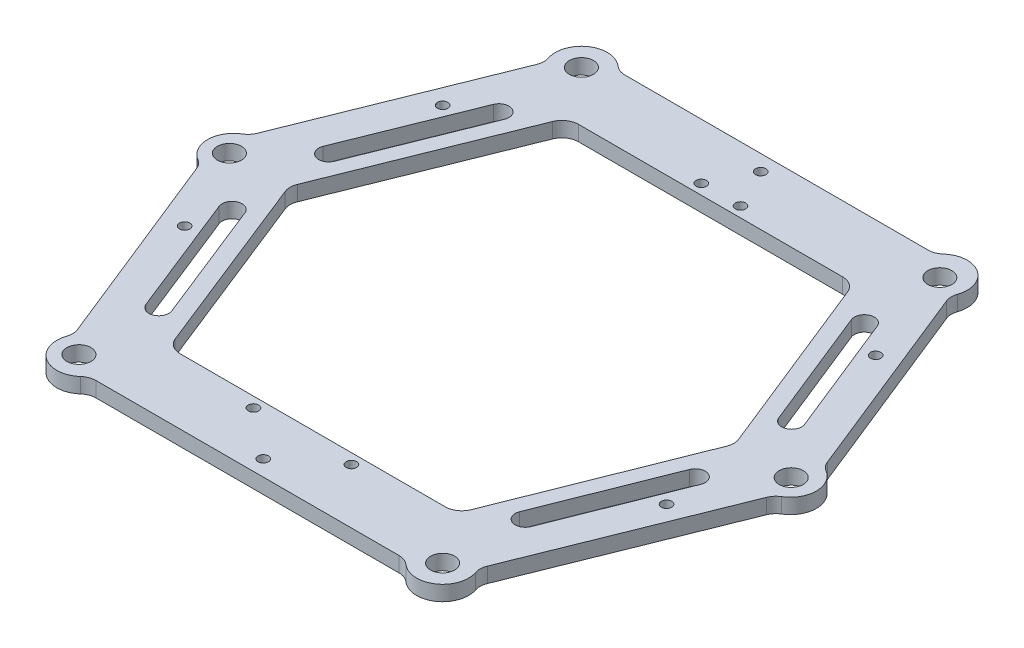
from build123d import *

# Parameters (mm, degrees)
BOSS_EXTRUDE1_DEPTH          = 4.6228
L_0_29_DIAMETER_HOLE1_D      = 7.366
F_1_8_0_125_DIAMETER_HOLE1_D = 3.175
CUT_EXTRUDE1_DEPTH           = 126.517349169
FILLET1_R                    = 5.08


with BuildPart() as part:
    # Sketch1 → Boss-Extrude1 (new body)
    # profile 1 of 25: a face of its own
    with BuildSketch(Plane(origin=(0, 0, 0), x_dir=(1, 0, 0), z_dir=(0, 1, 0))):
        Polygon((-90.8065372, 0), (-58.336285833, 80.8355), (0, 80.8355), (58.336285833, 80.8355), (90.8065372, 0), (58.336285833, -80.8355), (-58.336285833, -80.8355), align=None)
        Polygon((68.179802243, 0), (43.946974167, -60.8965), (-43.946974167, -60.8965), (-68.179802243, 0), (-43.8003315, 60.6933), (0, 60.6933), (43.8003315, 60.6933), align=None, mode=Mode.SUBTRACT)
    # profile 2 of 25: a face of its own
    with BuildSketch(Plane(origin=(0, 0, 0), x_dir=(1, 0, 0), z_dir=(0, 1, 0))):
        with BuildLine():
            ThreePointArc((-47.0535, 76.2), (-47.436281026, 78.635185304), (-48.547705346, 80.8355))
            Line((-48.547705346, 80.8355), (-58.336285833, 80.8355))
            Line((-58.336285833, 80.8355), (-61.822040842, 72.157626035))
            ThreePointArc((-61.822040842, 72.157626035), (-52.895466706, 68.544110341), (-47.0535, 76.2))
        make_face()
    # profile 3 of 25: a face of its own
    with BuildSketch(Plane(origin=(0, 0, 0), x_dir=(1, 0, 0), z_dir=(0, 1, 0))):
        with BuildLine():
            Line((-58.336285833, 80.8355), (-48.547705346, 80.8355))
            ThreePointArc((-48.547705346, 80.8355), (-59.334266157, 82.843789983), (-61.822040842, 72.157626035))
            Line((-61.822040842, 72.157626035), (-58.336285833, 80.8355))
        make_face()
    # profile 4 of 25: a face of its own
    with BuildSketch(Plane(origin=(0, 0, 0), x_dir=(1, 0, 0), z_dir=(0, 1, 0))):
        with BuildLine():
            ThreePointArc((-47.0535, 76.2), (-47.436281026, 78.635185304), (-48.547705346, 80.8355))
            Line((-48.547705346, 80.8355), (-58.336285833, 80.8355))
            Line((-58.336285833, 80.8355), (-61.822040842, 72.157626035))
            ThreePointArc((-61.822040842, 72.157626035), (-52.895466706, 68.544110341), (-47.0535, 76.2))
        make_face()
    # profile 5 of 25: a face of its own
    with BuildSketch(Plane(origin=(0, 0, 0), x_dir=(1, 0, 0), z_dir=(0, 1, 0))):
        with BuildLine():
            Line((-58.336285833, 80.8355), (-48.547705346, 80.8355))
            ThreePointArc((-48.547705346, 80.8355), (-59.334266157, 82.843789983), (-61.822040842, 72.157626035))
            Line((-61.822040842, 72.157626035), (-58.336285833, 80.8355))
        make_face()
    # profile 6 of 25: a face of its own
    with BuildSketch(Plane(origin=(0, 0, 0), x_dir=(1, 0, 0), z_dir=(0, 1, 0))):
        with BuildLine():
            ThreePointArc((62.9285, 76.2), (57.426185304, 83.754718974), (48.547705346, 80.8355))
            Line((48.547705346, 80.8355), (58.336285833, 80.8355))
            Line((58.336285833, 80.8355), (61.822040842, 72.157626035))
            ThreePointArc((61.822040842, 72.157626035), (62.646889659, 74.104466706), (62.9285, 76.2))
        make_face()
    # profile 7 of 25: a face of its own
    with BuildSketch(Plane(origin=(0, 0, 0), x_dir=(1, 0, 0), z_dir=(0, 1, 0))):
        with BuildLine():
            Line((58.336285833, 80.8355), (48.547705346, 80.8355))
            ThreePointArc((48.547705346, 80.8355), (50.647733843, 69.556210017), (61.822040842, 72.157626035))
            Line((61.822040842, 72.157626035), (58.336285833, 80.8355))
        make_face()
    # profile 8 of 25: a face of its own
    with BuildSketch(Plane(origin=(0, 0, 0), x_dir=(1, 0, 0), z_dir=(0, 1, 0))):
        with BuildLine():
            ThreePointArc((62.9285, 76.2), (57.426185304, 83.754718974), (48.547705346, 80.8355))
            Line((48.547705346, 80.8355), (58.336285833, 80.8355))
            Line((58.336285833, 80.8355), (61.822040842, 72.157626035))
            ThreePointArc((61.822040842, 72.157626035), (62.646889659, 74.104466706), (62.9285, 76.2))
        make_face()
    # profile 9 of 25: a face of its own
    with BuildSketch(Plane(origin=(0, 0, 0), x_dir=(1, 0, 0), z_dir=(0, 1, 0))):
        with BuildLine():
            Line((58.336285833, 80.8355), (48.547705346, 80.8355))
            ThreePointArc((48.547705346, 80.8355), (50.647733843, 69.556210017), (61.822040842, 72.157626035))
            Line((61.822040842, 72.157626035), (58.336285833, 80.8355))
        make_face()
    # profile 10 of 25: a face of its own
    with BuildSketch(Plane(origin=(0, 0, 0), x_dir=(1, 0, 0), z_dir=(0, 1, 0))):
        with BuildLine():
            ThreePointArc((93.0275, 0), (91.594047917, 4.549864498), (87.811432738, 7.456387202))
            Line((87.811432738, 7.456387202), (90.8065372, 0))
            Line((90.8065372, 0), (87.811432738, -7.456387202))
            ThreePointArc((87.811432738, -7.456387202), (91.594047917, -4.549864498), (93.0275, 0))
        make_face()
    # profile 11 of 25: a face of its own
    with BuildSketch(Plane(origin=(0, 0, 0), x_dir=(1, 0, 0), z_dir=(0, 1, 0))):
        with BuildLine():
            Line((90.8065372, 0), (87.811432738, 7.456387202))
            ThreePointArc((87.811432738, 7.456387202), (77.1525, 0), (87.811432738, -7.456387202))
            Line((87.811432738, -7.456387202), (90.8065372, 0))
        make_face()
    # profile 12 of 25: a face of its own
    with BuildSketch(Plane(origin=(0, 0, 0), x_dir=(1, 0, 0), z_dir=(0, 1, 0))):
        with BuildLine():
            ThreePointArc((93.0275, 0), (91.594047917, 4.549864498), (87.811432738, 7.456387202))
            Line((87.811432738, 7.456387202), (90.8065372, 0))
            Line((90.8065372, 0), (87.811432738, -7.456387202))
            ThreePointArc((87.811432738, -7.456387202), (91.594047917, -4.549864498), (93.0275, 0))
        make_face()
    # profile 13 of 25: a face of its own
    with BuildSketch(Plane(origin=(0, 0, 0), x_dir=(1, 0, 0), z_dir=(0, 1, 0))):
        with BuildLine():
            Line((90.8065372, 0), (87.811432738, 7.456387202))
            ThreePointArc((87.811432738, 7.456387202), (77.1525, 0), (87.811432738, -7.456387202))
            Line((87.811432738, -7.456387202), (90.8065372, 0))
        make_face()
    # profile 14 of 25: a face of its own
    with BuildSketch(Plane(origin=(0, 0, 0), x_dir=(1, 0, 0), z_dir=(0, 1, 0))):
        with BuildLine():
            ThreePointArc((62.9285, -76.2), (62.646889659, -74.104466706), (61.822040842, -72.157626035))
            Line((61.822040842, -72.157626035), (58.336285833, -80.8355))
            Line((58.336285833, -80.8355), (48.547705346, -80.8355))
            ThreePointArc((48.547705346, -80.8355), (57.426185304, -83.754718974), (62.9285, -76.2))
        make_face()
    # profile 15 of 25: a face of its own
    with BuildSketch(Plane(origin=(0, 0, 0), x_dir=(1, 0, 0), z_dir=(0, 1, 0))):
        with BuildLine():
            Line((58.336285833, -80.8355), (61.822040842, -72.157626035))
            ThreePointArc((61.822040842, -72.157626035), (50.647733843, -69.556210017), (48.547705346, -80.8355))
            Line((48.547705346, -80.8355), (58.336285833, -80.8355))
        make_face()
    # profile 16 of 25: a face of its own
    with BuildSketch(Plane(origin=(0, 0, 0), x_dir=(1, 0, 0), z_dir=(0, 1, 0))):
        with BuildLine():
            ThreePointArc((62.9285, -76.2), (62.646889659, -74.104466706), (61.822040842, -72.157626035))
            Line((61.822040842, -72.157626035), (58.336285833, -80.8355))
            Line((58.336285833, -80.8355), (48.547705346, -80.8355))
            ThreePointArc((48.547705346, -80.8355), (57.426185304, -83.754718974), (62.9285, -76.2))
        make_face()
    # profile 17 of 25: a face of its own
    with BuildSketch(Plane(origin=(0, 0, 0), x_dir=(1, 0, 0), z_dir=(0, 1, 0))):
        with BuildLine():
            Line((58.336285833, -80.8355), (61.822040842, -72.157626035))
            ThreePointArc((61.822040842, -72.157626035), (50.647733843, -69.556210017), (48.547705346, -80.8355))
            Line((48.547705346, -80.8355), (58.336285833, -80.8355))
        make_face()
    # profile 18 of 25: a face of its own
    with BuildSketch(Plane(origin=(0, 0, 0), x_dir=(1, 0, 0), z_dir=(0, 1, 0))):
        with BuildLine():
            ThreePointArc((-47.0535, -76.2), (-52.895466706, -68.544110341), (-61.822040842, -72.157626035))
            Line((-61.822040842, -72.157626035), (-58.336285833, -80.8355))
            Line((-58.336285833, -80.8355), (-48.547705346, -80.8355))
            ThreePointArc((-48.547705346, -80.8355), (-47.436281026, -78.635185304), (-47.0535, -76.2))
        make_face()
    # profile 19 of 25: a face of its own
    with BuildSketch(Plane(origin=(0, 0, 0), x_dir=(1, 0, 0), z_dir=(0, 1, 0))):
        with BuildLine():
            Line((-58.336285833, -80.8355), (-61.822040842, -72.157626035))
            ThreePointArc((-61.822040842, -72.157626035), (-59.334266157, -82.843789983), (-48.547705346, -80.8355))
            Line((-48.547705346, -80.8355), (-58.336285833, -80.8355))
        make_face()
    # profile 20 of 25: a face of its own
    with BuildSketch(Plane(origin=(0, 0, 0), x_dir=(1, 0, 0), z_dir=(0, 1, 0))):
        with BuildLine():
            ThreePointArc((-47.0535, -76.2), (-52.895466706, -68.544110341), (-61.822040842, -72.157626035))
            Line((-61.822040842, -72.157626035), (-58.336285833, -80.8355))
            Line((-58.336285833, -80.8355), (-48.547705346, -80.8355))
            ThreePointArc((-48.547705346, -80.8355), (-47.436281026, -78.635185304), (-47.0535, -76.2))
        make_face()
    # profile 21 of 25: a face of its own
    with BuildSketch(Plane(origin=(0, 0, 0), x_dir=(1, 0, 0), z_dir=(0, 1, 0))):
        with BuildLine():
            Line((-58.336285833, -80.8355), (-61.822040842, -72.157626035))
            ThreePointArc((-61.822040842, -72.157626035), (-59.334266157, -82.843789983), (-48.547705346, -80.8355))
            Line((-48.547705346, -80.8355), (-58.336285833, -80.8355))
        make_face()
    # profile 22 of 25: a face of its own
    with BuildSketch(Plane(origin=(0, 0, 0), x_dir=(1, 0, 0), z_dir=(0, 1, 0))):
        with BuildLine():
            ThreePointArc((-77.1525, 0), (-80.540135502, 6.504047917), (-87.811432738, 7.456387202))
            Line((-87.811432738, 7.456387202), (-90.8065372, 0))
            Line((-90.8065372, 0), (-87.811432738, -7.456387202))
            ThreePointArc((-87.811432738, -7.456387202), (-80.540135502, -6.504047917), (-77.1525, 0))
        make_face()
    # profile 23 of 25: a face of its own
    with BuildSketch(Plane(origin=(0, 0, 0), x_dir=(1, 0, 0), z_dir=(0, 1, 0))):
        with BuildLine():
            Line((-90.8065372, 0), (-87.811432738, 7.456387202))
            ThreePointArc((-87.811432738, 7.456387202), (-93.0275, 0), (-87.811432738, -7.456387202))
            Line((-87.811432738, -7.456387202), (-90.8065372, 0))
        make_face()
    # profile 24 of 25: a face of its own
    with BuildSketch(Plane(origin=(0, 0, 0), x_dir=(1, 0, 0), z_dir=(0, 1, 0))):
        with BuildLine():
            ThreePointArc((-77.1525, 0), (-80.540135502, 6.504047917), (-87.811432738, 7.456387202))
            Line((-87.811432738, 7.456387202), (-90.8065372, 0))
            Line((-90.8065372, 0), (-87.811432738, -7.456387202))
            ThreePointArc((-87.811432738, -7.456387202), (-80.540135502, -6.504047917), (-77.1525, 0))
        make_face()
    # profile 25 of 25: a face of its own
    with BuildSketch(Plane(origin=(0, 0, 0), x_dir=(1, 0, 0), z_dir=(0, 1, 0))):
        with BuildLine():
            Line((-90.8065372, 0), (-87.811432738, 7.456387202))
            ThreePointArc((-87.811432738, 7.456387202), (-93.0275, 0), (-87.811432738, -7.456387202))
            Line((-87.811432738, -7.456387202), (-90.8065372, 0))
        make_face()
    extrude(amount=BOSS_EXTRUDE1_DEPTH)

    # L (0.29) Diameter Hole1 (through all)
    with Locations(Plane(origin=(0, 4.6228, 0), x_dir=(1, 0, 0), z_dir=(0, 1, 0))):
        with Locations((-54.991, 76.2), (85.617853256, -0.292694294), (55.392678921, 75.357641332), (54.991, -76.2), (-55.78834552, -76.570331566), (-86.069772248, -0.292694294)):
            Hole(L_0_29_DIAMETER_HOLE1_D / 2)

    # 1/8 (0.125) Diameter Hole1 (through all)
    with Locations(Plane(origin=(0, 0, -76.0095), x_dir=(0, 0, -1), z_dir=(0, -1, 0))):
        with Locations((0, 0), (-102.404754969, -73.6346), (-31.039277207, -66.17335), (-31.039277207, 66.17335), (-102.404754969, 73.6346), (-152.019, 0), (-140.0556, 14.9733), (-140.0556, -14.9733), (-12.1666, 5.98805), (-12.1666, -5.98805)):
            Hole(F_1_8_0_125_DIAMETER_HOLE1_D / 2)

    # Sketch7 → Cut-Extrude1 (cut, through all)
    with BuildSketch(Plane(origin=(0, 4.6228, 0), x_dir=(1, 0, 0), z_dir=(0, 1, 0))):
        with BuildLine():
            Line((-67.94304322, -13.647533379), (-53.15176289, -50.817656478))
            ThreePointArc((-53.15176289, -50.817656478), (-54.856817577, -54.776620549), (-58.815781648, -53.071565862))
            Line((-58.815781648, -53.071565862), (-73.607061978, -15.901442763))
            ThreePointArc((-73.607061978, -15.901442763), (-71.902007291, -11.942478692), (-67.94304322, -13.647533379))
        make_face()
        with BuildLine():
            Line((-53.012626887, 50.706540309), (-67.923956426, 13.584413802))
            ThreePointArc((-67.923956426, 13.584413802), (-71.88841022, 11.892162605), (-73.580661417, 15.856616398))
            Line((-73.580661417, 15.856616398), (-58.669331879, 52.978742905))
            ThreePointArc((-58.669331879, 52.978742905), (-54.704878085, 54.670994103), (-53.012626887, 50.706540309))
        make_face()
        with BuildLine():
            Line((53.012626887, 50.706540309), (67.923956426, 13.584413802))
            ThreePointArc((67.923956426, 13.584413802), (71.88841022, 11.892162605), (73.580661417, 15.856616398))
            Line((73.580661417, 15.856616398), (58.669331879, 52.978742905))
            ThreePointArc((58.669331879, 52.978742905), (54.704878085, 54.670994103), (53.012626887, 50.706540309))
        make_face()
        with BuildLine():
            Line((67.94304322, -13.647533379), (53.15176289, -50.817656478))
            ThreePointArc((53.15176289, -50.817656478), (54.856817577, -54.776620549), (58.815781648, -53.071565862))
            Line((58.815781648, -53.071565862), (73.607061978, -15.901442763))
            ThreePointArc((73.607061978, -15.901442763), (71.902007291, -11.942478692), (67.94304322, -13.647533379))
        make_face()
    extrude(amount=-CUT_EXTRUDE1_DEPTH, mode=Mode.SUBTRACT)

    # Fillet1
    fillet1_edges = [part.edges().sort_by_distance(p)[0] for p in [
        (-43.946974167, 2.3114, 60.8965),
        (43.946974167, 2.3114, 60.8965),
        (68.179802243, 2.3114, 0),
        (43.8003315, 2.3114, -60.6933),
        (-43.8003315, 2.3114, -60.6933),
        (-68.179802243, 2.3114, 0),
        (48.547705346, 2.3114, -80.8355),
        (61.822040842, 2.3114, -72.157626035),
        (87.811432738, 2.3114, -7.456387202),
        (87.811432738, 2.3114, 7.456387202),
        (61.822040842, 2.3114, 72.157626035),
        (48.547705346, 2.3114, 80.8355),
        (-48.547705346, 2.3114, 80.8355),
        (-61.822040842, 2.3114, 72.157626035),
        (-87.811432738, 2.3114, 7.456387202),
        (-87.811432738, 2.3114, -7.456387202),
        (-61.822040842, 2.3114, -72.157626035),
        (-48.547705346, 2.3114, -80.8355),
    ]]
    fillet(fillet1_edges, radius=FILLET1_R)


solid = part.part
